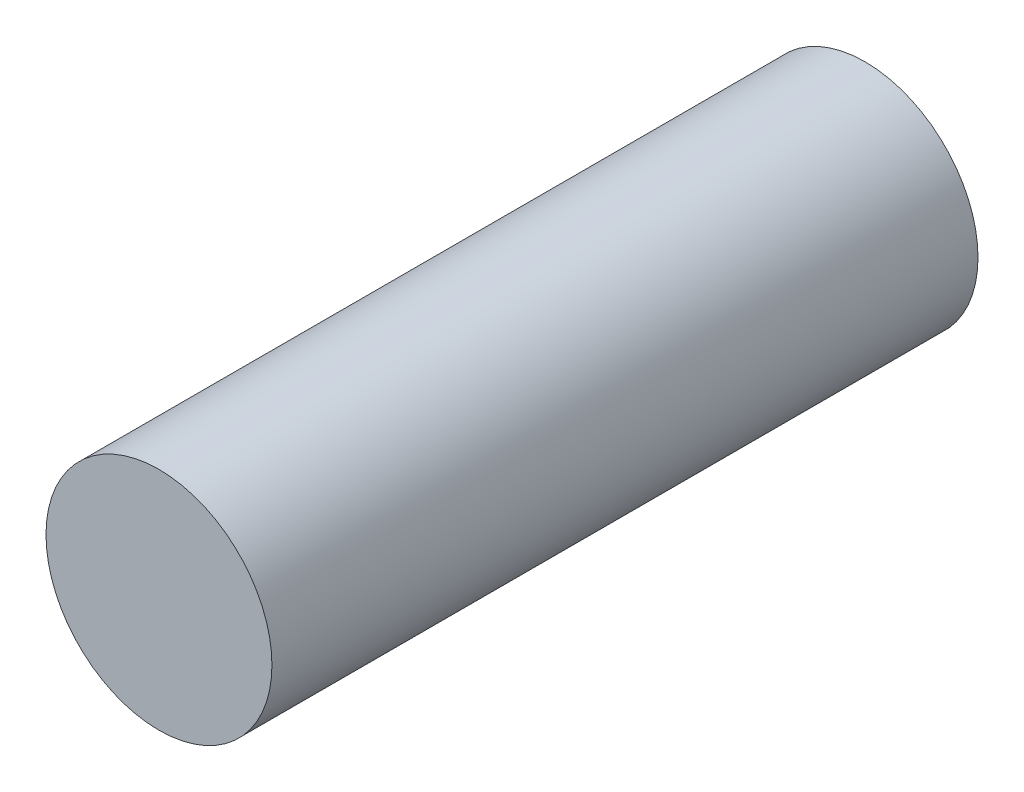
from build123d import *

# Parameters (mm, degrees)
SKETCH1_R           = 3.2
BOSS_EXTRUDE1_DEPTH = 20


with BuildPart() as part:
    # Sketch1 → Boss-Extrude1 (new body)
    with BuildSketch(Plane.XY):
        Circle(SKETCH1_R)
    extrude(amount=BOSS_EXTRUDE1_DEPTH)


solid = part.part
